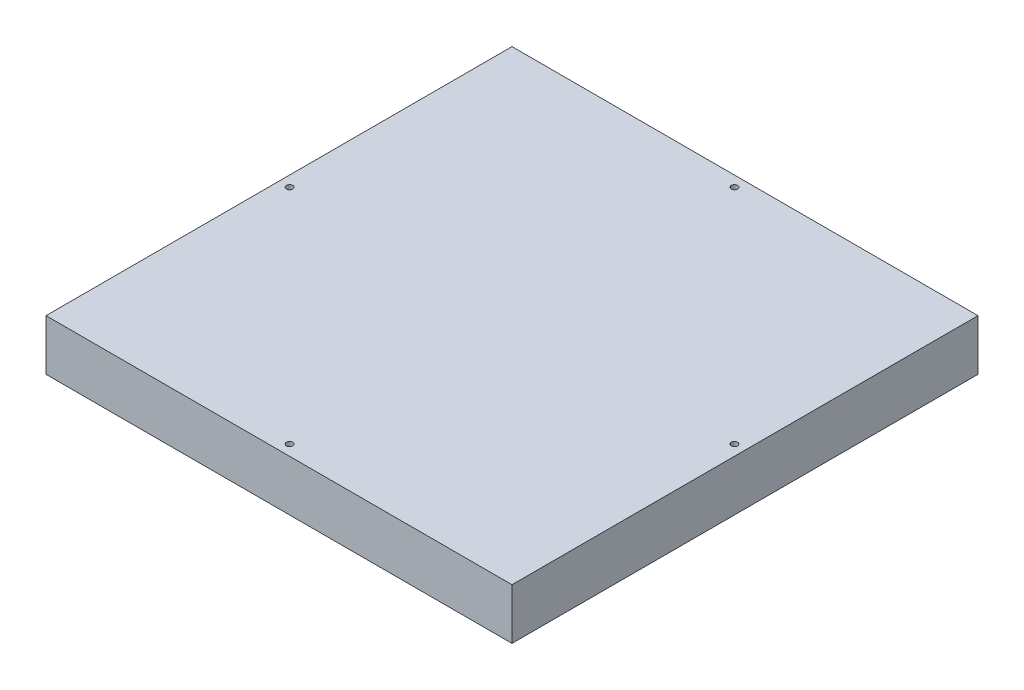
from build123d import *

# Parameters (mm, degrees)
SKETCH1_W           = 220
SKETCH1_H           = 220
SKETCH1_R           = 1.5
BOSS_EXTRUDE1_DEPTH = 24


with BuildPart() as part:
    # Sketch1 → Boss-Extrude1 (new body)
    with BuildSketch(Plane(origin=(0, 0, 0), x_dir=(1, 0, 0), z_dir=(0, 1, 0))):
        Rectangle(SKETCH1_W, SKETCH1_H)
        with Locations(Location((-105, 0, 0), (0, 0, 270))):
            Circle(SKETCH1_R, mode=Mode.SUBTRACT)
        with Locations(Location((105, 0, 0), (0, 0, 270))):
            Circle(SKETCH1_R, mode=Mode.SUBTRACT)
        with Locations(Location((0, -105, 0), (0, 0, 270))):
            Circle(SKETCH1_R, mode=Mode.SUBTRACT)
        with Locations(Location((0, 105, 0), (0, 0, 270))):
            Circle(SKETCH1_R, mode=Mode.SUBTRACT)
    extrude(amount=BOSS_EXTRUDE1_DEPTH)


solid = part.part
